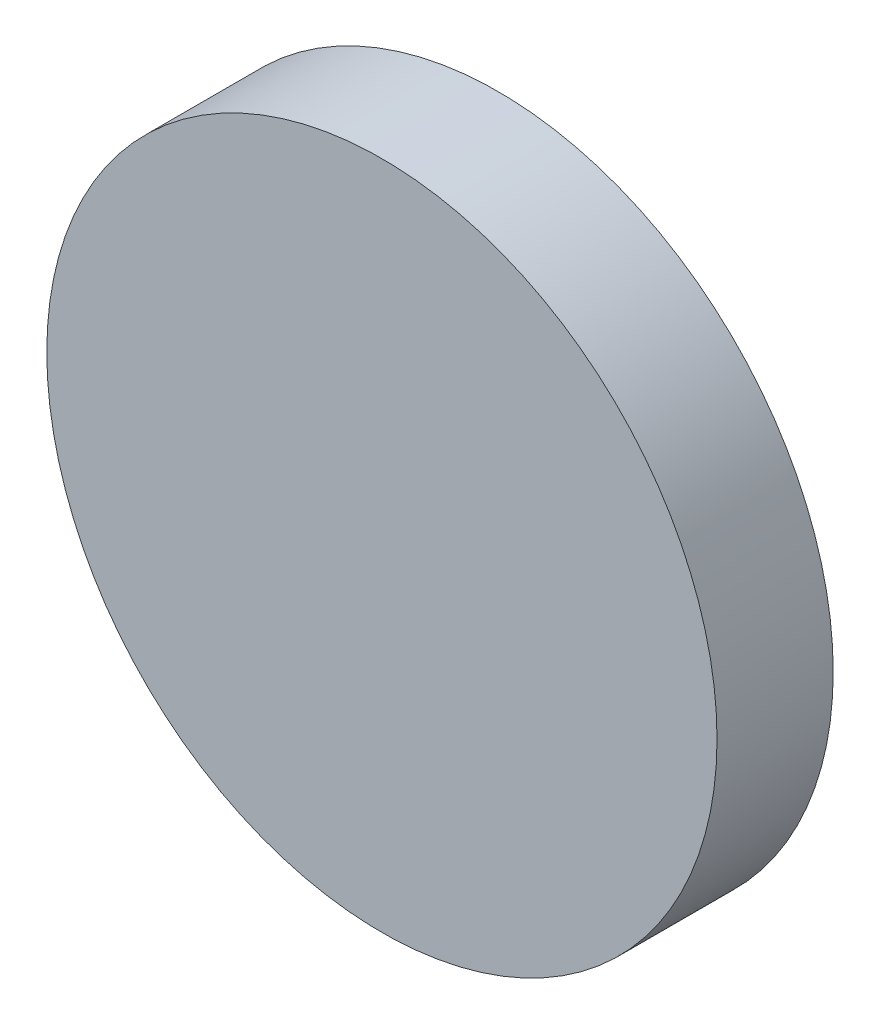
from build123d import *

# Parameters (mm, degrees)
SKETCH1_R            = 47.625
BOSS_EXTRUDE1_DEPTH  = 3.81
BOSS_EXTRUDE2_START  = 12.7
SKETCH4_R            = 47.625
SKETCH4_R_2          = 44.45
BOSS_EXTRUDE2_DEPTH  = 12.7
SKETCH7_W            = 88.9
SKETCH7_H            = 1.778
BOSS_EXTRUDE14_DEPTH = 5.08


with BuildPart() as part:
    # Sketch1 → Boss-Extrude1 (new body)
    with BuildSketch(Plane.XY):
        with Locations(Location((0, 0, 0), (0, 0, 180))):
            Circle(SKETCH1_R)
    extrude(amount=BOSS_EXTRUDE1_DEPTH)

    # Sketch4 → Boss-Extrude2 (add)
    with BuildSketch(Plane(origin=(0, 0, 0), x_dir=(-1, 0, 0), z_dir=(0, 0, -1)).offset(BOSS_EXTRUDE2_START)):
        Circle(SKETCH4_R)
        with Locations(Location((0, 0, 0), (0, 0, 180))):
            Circle(SKETCH4_R_2, mode=Mode.SUBTRACT)
    extrude(amount=-BOSS_EXTRUDE2_DEPTH)

    # Sketch7 → Boss-Extrude14 (add)
    with BuildSketch(Plane(origin=(0, 0, 0), x_dir=(-1, 0, 0), z_dir=(0, 0, -1))):
        with Locations((-0.004601407, -1.528565374)):
            Rectangle(SKETCH7_W, SKETCH7_H)
    extrude(amount=BOSS_EXTRUDE14_DEPTH)


solid = part.part
